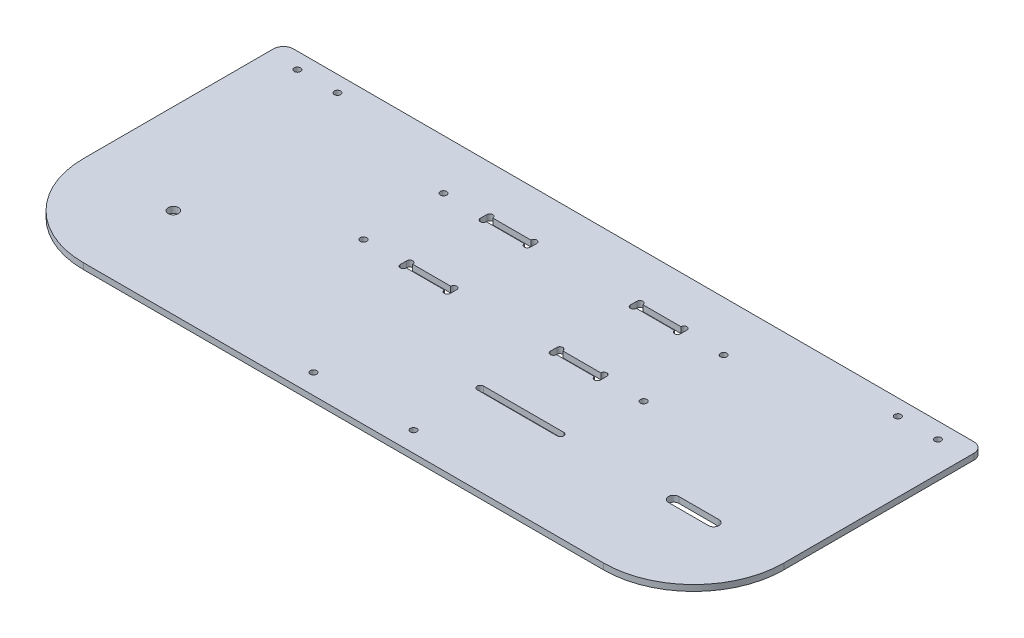
from build123d import *

# Parameters (mm, degrees)
SKETCH1_R           = 2.6
BOSS_EXTRUDE1_DEPTH = 3
SKETCH2_W           = 3
SKETCH2_H           = 3.2
SKETCH2_W_2         = 19
SKETCH2_R           = 1.6
CUT_EXTRUDE1_DEPTH  = 10
FILLET1_R           = 5
SKETCH3_R           = 1.6
CUT_EXTRUDE2_DEPTH  = 321.989096388


with BuildPart() as part:
    # Sketch1 → Boss-Extrude1 (new body)
    # profile 1 of 2: a face of its own
    with BuildSketch(Plane(origin=(0, 0, 0), x_dir=(1, 0, 0), z_dir=(0, 1, 0))):
        with BuildLine():
            Line((0, -45), (260, -45))
            ThreePointArc((260, -45), (305, 0), (260, 45))
            Line((260, 45), (0, 45))
            ThreePointArc((0, 45), (-45, 0), (0, -45))
        make_face()
        with Locations(Location((0, 0, 0), (0, 0, 270))):
            Circle(SKETCH1_R, mode=Mode.SUBTRACT)
        with BuildLine():
            ThreePointArc((250, 2.6), (247.4, 0), (250, -2.6))
            Line((250, -2.6), (270, -2.6))
            ThreePointArc((270, -2.6), (272.6, 0), (270, 2.6))
            Line((270, 2.6), (250, 2.6))
        make_face(mode=Mode.SUBTRACT)
    # profile 2 of 2: a face of its own
    with BuildSketch(Plane(origin=(0, 0, 0), x_dir=(1, 0, 0), z_dir=(0, 1, 0))):
        with BuildLine():
            ThreePointArc((-45, 0), (-31.819805153, 31.819805153), (0, 45))
            Line((0, 45), (260, 45))
            ThreePointArc((260, 45), (291.819805153, 31.819805153), (305, 0))
            Line((305, 0), (305, 100))
            Line((305, 100), (-45, 100))
            Line((-45, 100), (-45, 0))
        make_face()
    extrude(amount=BOSS_EXTRUDE1_DEPTH)

    # Sketch2 → Cut-Extrude1 (cut)
    with BuildSketch(Plane.XZ):
        with Locations((81.5, -35)):
            Rectangle(SKETCH2_W, SKETCH2_H)
        with BuildLine():
            Line((80, -33.4), (83, -33.4))
            ThreePointArc((83, -33.4), (81.5, -31.9), (80, -33.4))
        make_face()
        with BuildLine():
            ThreePointArc((80, -36.6), (81.5, -38.1), (83, -36.6))
            Line((83, -36.6), (80, -36.6))
        make_face()
        with Locations((92.5, -35)):
            Rectangle(SKETCH2_W_2, SKETCH2_H)
        with BuildLine():
            ThreePointArc((105, -33.4), (103.5, -31.9), (102, -33.4))
            Line((102, -33.4), (105, -33.4))
        make_face()
        with Locations((103.5, -35)):
            Rectangle(SKETCH2_W, SKETCH2_H)
        with BuildLine():
            Line((105, -36.6), (102, -36.6))
            ThreePointArc((102, -36.6), (103.5, -38.1), (105, -36.6))
        make_face()
        with BuildLine():
            ThreePointArc((83, -73.4), (81.5, -71.9), (80, -73.4))
            Line((80, -73.4), (83, -73.4))
        make_face()
        with Locations((81.5, -75)):
            Rectangle(SKETCH2_W, SKETCH2_H)
        with Locations((92.5, -75)):
            Rectangle(SKETCH2_W_2, SKETCH2_H)
        with BuildLine():
            Line((83, -76.6), (80, -76.6))
            ThreePointArc((80, -76.6), (81.5, -78.1), (83, -76.6))
        make_face()
        with BuildLine():
            ThreePointArc((105, -73.4), (103.5, -71.9), (102, -73.4))
            Line((102, -73.4), (105, -73.4))
        make_face()
        with Locations((103.5, -75)):
            Rectangle(SKETCH2_W, SKETCH2_H)
        with BuildLine():
            Line((105, -76.6), (102, -76.6))
            ThreePointArc((102, -76.6), (103.5, -78.1), (105, -76.6))
        make_face()
        with BuildLine():
            Line((155, -33.4), (158, -33.4))
            ThreePointArc((158, -33.4), (156.5, -31.9), (155, -33.4))
        make_face()
        with Locations((156.5, -35)):
            Rectangle(SKETCH2_W, SKETCH2_H)
        with BuildLine():
            ThreePointArc((155, -36.6), (156.5, -38.1), (158, -36.6))
            Line((158, -36.6), (155, -36.6))
        make_face()
        with Locations((167.5, -35)):
            Rectangle(SKETCH2_W_2, SKETCH2_H)
        with BuildLine():
            Line((177, -33.4), (180, -33.4))
            ThreePointArc((180, -33.4), (178.5, -31.9), (177, -33.4))
        make_face()
        with Locations((178.5, -35)):
            Rectangle(SKETCH2_W, SKETCH2_H)
        with BuildLine():
            ThreePointArc((177, -36.6), (178.5, -38.1), (180, -36.6))
            Line((180, -36.6), (177, -36.6))
        make_face()
        with BuildLine():
            ThreePointArc((158, -73.4), (156.5, -71.9), (155, -73.4))
            Line((155, -73.4), (158, -73.4))
        make_face()
        with Locations((156.5, -75)):
            Rectangle(SKETCH2_W, SKETCH2_H)
        with BuildLine():
            Line((158, -76.6), (155, -76.6))
            ThreePointArc((155, -76.6), (156.5, -78.1), (158, -76.6))
        make_face()
        with Locations((167.5, -75)):
            Rectangle(SKETCH2_W_2, SKETCH2_H)
        with BuildLine():
            ThreePointArc((180, -73.4), (178.5, -71.9), (177, -73.4))
            Line((177, -73.4), (180, -73.4))
        make_face()
        with Locations((178.5, -75)):
            Rectangle(SKETCH2_W, SKETCH2_H)
        with BuildLine():
            Line((180, -76.6), (177, -76.6))
            ThreePointArc((177, -76.6), (178.5, -78.1), (180, -76.6))
        make_face()
        with Locations(Location((200, -75, 0), (0, 0, 270))):
            Circle(SKETCH2_R)
        with Locations(Location((290, -92, 0), (0, 0, 270))):
            Circle(SKETCH2_R)
        with Locations(Location((270, -92, 0), (0, 0, 270))):
            Circle(SKETCH2_R)
        with Locations(Location((60, -35, 0), (0, 0, 90))):
            Circle(SKETCH2_R)
        with Locations(Location((60, -75, 0), (0, 0, 270))):
            Circle(SKETCH2_R)
        with Locations(Location((-10, -92, 0), (0, 0, 270))):
            Circle(SKETCH2_R)
        with Locations(Location((-30, -92, 0), (0, 0, 270))):
            Circle(SKETCH2_R)
        with Locations(Location((200, -35, 0), (0, 0, 270))):
            Circle(SKETCH2_R)
    extrude(amount=-CUT_EXTRUDE1_DEPTH, mode=Mode.SUBTRACT)

    # Fillet1
    fillet1_edges = [part.edges().sort_by_distance(p)[0] for p in [
        (-45, 1.5, -100),
        (305, 1.5, -100),
    ]]
    fillet(fillet1_edges, radius=FILLET1_R)

    # Sketch3 → Cut-Extrude2 (cut, through all)
    with BuildSketch(Plane.XZ):
        with Locations(Location((105, 35, 0), (0, 0, 270))):
            Circle(SKETCH3_R)
        with Locations(Location((155, 35, 0), (0, 0, 270))):
            Circle(SKETCH3_R)
        with BuildLine():
            Line((193.4, -1.6), (153.4, -1.6))
            ThreePointArc((153.4, -1.6), (151.8, 0), (153.4, 1.6))
            Line((153.4, 1.6), (193.4, 1.6))
            ThreePointArc((193.4, 1.6), (195, 0), (193.4, -1.6))
        make_face()
    extrude(amount=-CUT_EXTRUDE2_DEPTH, mode=Mode.SUBTRACT)


solid = part.part
